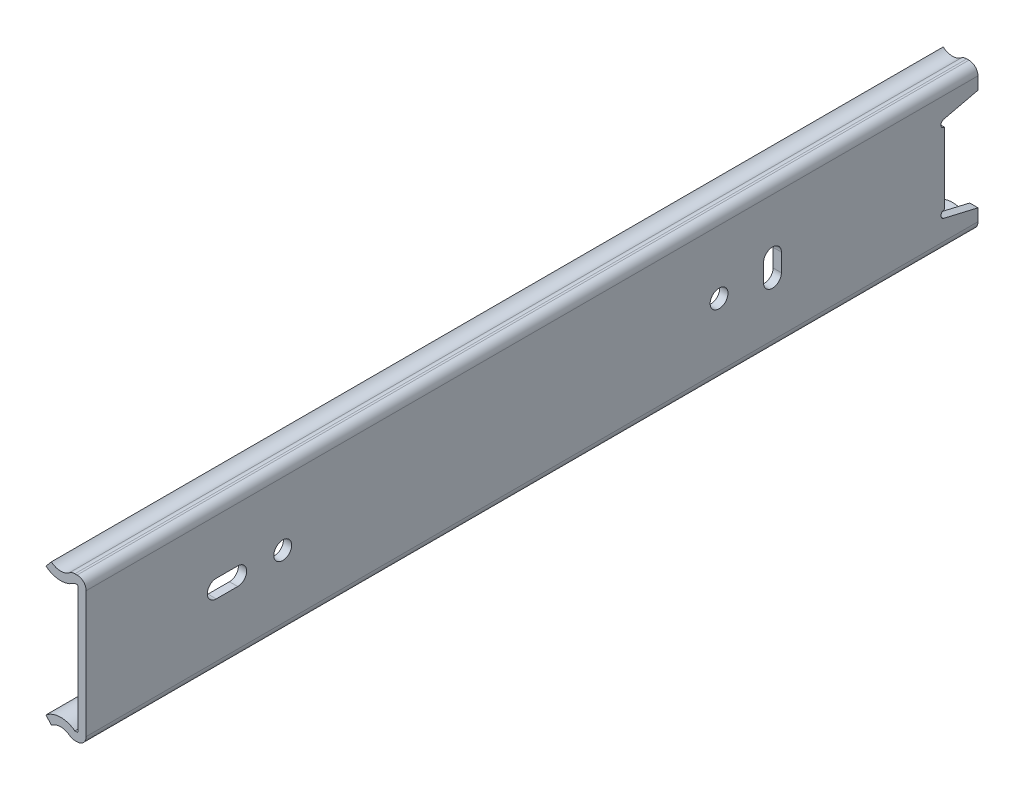
from build123d import *

# Parameters (mm, degrees)
BOSS_EXTRUDE1_DEPTH = 150
CUT_EXTRUDE2_DEPTH  = 151.642968673
SKETCH4_R           = 1.5
CUT_EXTRUDE3_DEPTH  = 151.642968673


with BuildPart() as part:
    # Sketch1 → Boss-Extrude1 (new body)
    with BuildSketch(Plane.XY):
        with BuildLine():
            Line((5.164341455, -10.750486483), (5.541822139, -10.750486483))
            ThreePointArc((5.541822139, -10.750486483), (5.628611698, -10.711655392), (5.6642, -10.623486496))
            Line((5.6642, -10.623486496), (5.6642, 10.623486496))
            ThreePointArc((5.6642, 10.623486496), (5.627002565, 10.713289048), (5.537200013, 10.750486483))
            Line((5.537200013, 10.750486483), (5.164341455, 10.750486483))
            ThreePointArc((5.164341455, 10.750486483), (5.123513594, 10.743744895), (5.087020295, 10.724235863))
            ThreePointArc((5.087020295, 10.724235863), (2.674694689, 9.938287609), (0.304054167, 10.842219578))
            Line((0.304054167, 10.842219578), (1.208194452, 11.907179363))
            ThreePointArc((1.208194452, 11.907179363), (2.709144677, 11.334862777), (4.236487447, 11.83247901))
            ThreePointArc((4.236487447, 11.83247901), (4.67440708, 12.066587417), (5.164341455, 12.147486483))
            Line((5.164341455, 12.147486483), (5.537200013, 12.147486483))
            ThreePointArc((5.537200013, 12.147486483), (6.614830738, 11.701117221), (7.0612, 10.623486496))
            Line((7.0612, 10.623486496), (7.0612, -10.623486496))
            ThreePointArc((7.0612, -10.623486496), (6.614830738, -11.701117221), (5.537200013, -12.147486483))
            ThreePointArc((5.537200013, -12.147486483), (5.350770734, -12.150925507), (5.164341455, -12.147486483))
            ThreePointArc((5.164341455, -12.147486483), (4.67440708, -12.066587417), (4.236487447, -11.83247901))
            ThreePointArc((4.236487447, -11.83247901), (2.709144677, -11.334862777), (1.208194452, -11.907179363))
            Line((1.208194452, -11.907179363), (0.304054167, -10.842219578))
            ThreePointArc((0.304054167, -10.842219578), (2.718249509, -9.951365406), (5.164341455, -10.750486483))
        make_face()
    extrude(amount=BOSS_EXTRUDE1_DEPTH)

    # Sketch2 → Cut-Extrude2 (cut, through all)
    with BuildSketch(Plane(origin=(7.0612, 0, 0), x_dir=(0, 0, -1), z_dir=(1, 0, 0))):
        with BuildLine():
            Line((0.119534124, 8.556064117), (0.119534124, -8.622507572))
            Line((0.119534124, -8.622507572), (-5.739792333, -7.254437811))
            ThreePointArc((-5.739792333, -7.254437811), (-6.226240725, -6.563404626), (-5.595417274, -6.001069606))
            Line((-5.595417274, -6.001069606), (-5.595417274, 5.934626152))
            ThreePointArc((-5.595417274, 5.934626152), (-6.226240725, 6.496961172), (-5.739792333, 7.187994357))
            Line((-5.739792333, 7.187994357), (0.119534124, 8.556064117))
        make_face()
    extrude(amount=-CUT_EXTRUDE2_DEPTH, mode=Mode.SUBTRACT)

    # Sketch4 → Cut-Extrude3 (cut, through all)
    with BuildSketch(Plane(origin=(7.0612, 0, 0), x_dir=(0, 0, -1), z_dir=(1, 0, 0))):
        with Locations((-116.937524646, -0.007606355)):
            Circle(SKETCH4_R)
        with Locations((-43.552387309, -0.024489344)):
            Circle(SKETCH4_R)
        with BuildLine():
            Line((-33.064580696, 1.474128733), (-33.064580696, -1.525871267))
            ThreePointArc((-33.064580696, -1.525871267), (-34.564580696, -3.025871267), (-36.064580696, -1.525871267))
            Line((-36.064580696, -1.525871267), (-36.064580696, 1.474128733))
            ThreePointArc((-36.064580696, 1.474128733), (-34.564580696, 2.974128733), (-33.064580696, 1.474128733))
        make_face()
        with BuildLine():
            Line((-128.12384742, 1.494967211), (-124.507385363, 1.494135207))
            ThreePointArc((-124.507385363, 1.494135207), (-123.007730493, -0.006209843), (-124.508075543, -1.505864713))
            Line((-124.508075543, -1.505864713), (-128.1245376, -1.50503271))
            ThreePointArc((-128.1245376, -1.50503271), (-129.62419247, -0.00468766), (-128.12384742, 1.494967211))
        make_face()
    extrude(amount=-CUT_EXTRUDE3_DEPTH, mode=Mode.SUBTRACT)


solid = part.part
